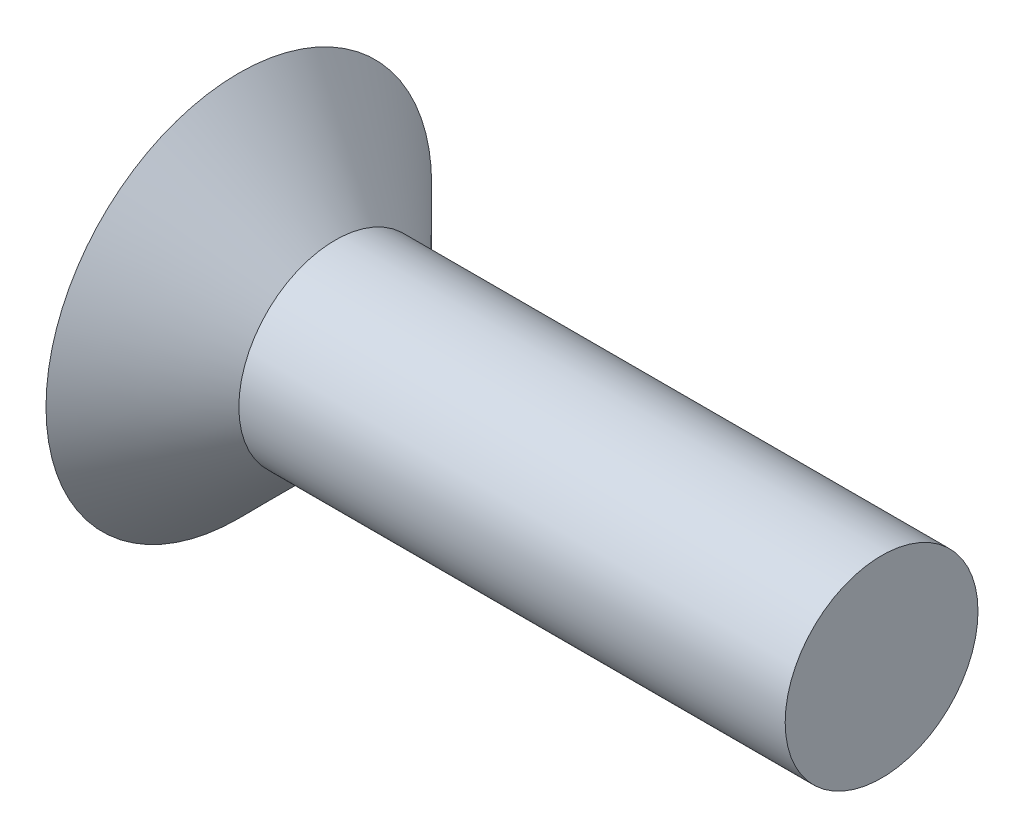
from build123d import *

# Parameters (mm, degrees)
CUT_EXTRUDE_1_DEPTH = 1


with BuildPart() as part:
    # 草图1 → 旋转1 (revolve)
    with BuildSketch(Plane.XY, mode=Mode.PRIVATE) as revolve_1_sk:
        Polygon((0, 0), (0, 3), (1.5, 1.5), (10, 1.5), (10, 0), align=None)
    revolve(revolve_1_sk.sketch.rotate(Axis((0, 0, 0), (1, 0, 0)), 90), axis=Axis((0, 0, 0), (1, 0, 0)))

    # 草图2 → 切除-拉伸1 (cut)
    with BuildSketch(Plane.ZY):
        Polygon((0, 1.154700538), (-1, 0.577350269), (-1, -0.577350269), (0, -1.154700538), (1, -0.577350269), (1, 0.577350269), align=None)
    extrude(amount=-CUT_EXTRUDE_1_DEPTH, mode=Mode.SUBTRACT)


solid = part.part
